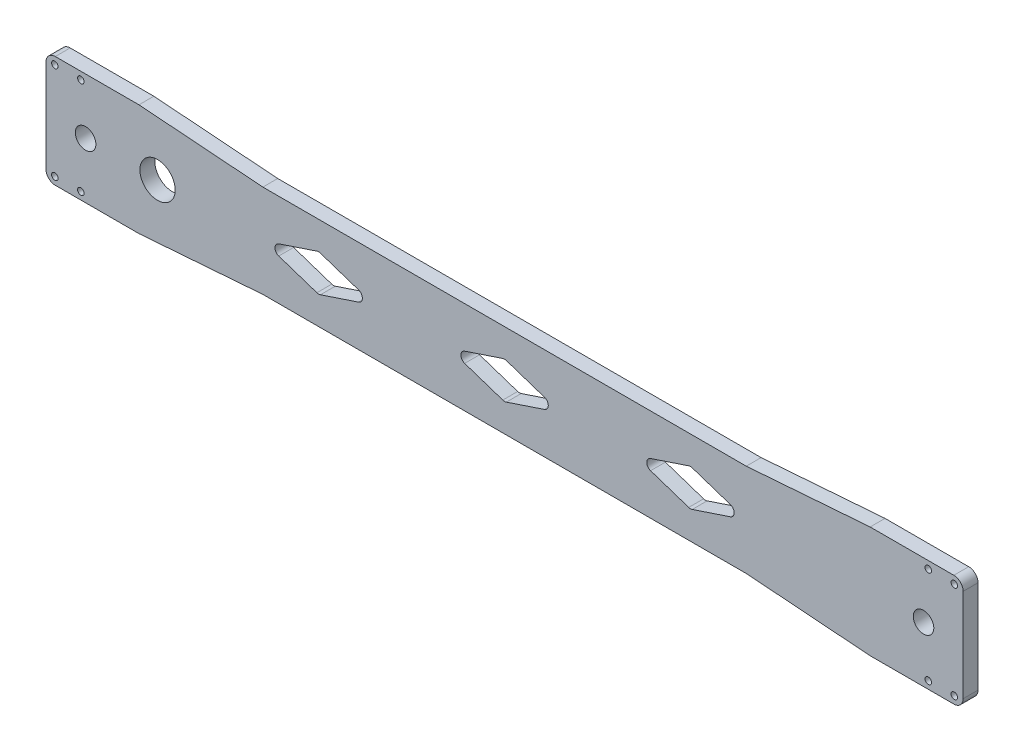
from build123d import *

# Parameters (mm, degrees)
EXTRUDE_1_DEPTH     = 8
FILLET_1_R          = 3
FILLET_2_R          = 5
SKETCH_2_R          = 1.75
SKETCH_2_R_2        = 5.525
CUT_EXTRUDE_1_DEPTH = 10
SKETCH_3_R          = 9.5
CUT_EXTRUDE_2_DEPTH = 497.999889336


with BuildPart() as part:
    # 草图1 → 凸台-拉伸1 (new body)
    with BuildSketch(Plane.XY):
        Polygon((0, 0), (50, 0), (116.65, -5), (376.65, -5), (443.3, 0), (493.3, 0), (493.3, -60), (443.3, -60), (376.65, -55), (116.65, -55), (50, -60), (0, -60), align=None)
        Polygon((116.65, -30), (146.65, -20), (176.65, -30), (146.65, -40), align=None, mode=Mode.SUBTRACT)
        Polygon((216.65, -30), (246.65, -20), (276.65, -30), (246.65, -40), align=None, mode=Mode.SUBTRACT)
        Polygon((316.65, -30), (346.65, -20), (376.65, -30), (346.65, -40), align=None, mode=Mode.SUBTRACT)
    extrude(amount=EXTRUDE_1_DEPTH)

    # 圆角1
    fillet_1_edges = [part.edges().sort_by_distance(p)[0] for p in [
        (216.65, -30, 4),
        (246.65, -40, 4),
        (276.65, -30, 4),
        (246.65, -20, 4),
        (116.65, -30, 4),
        (146.65, -40, 4),
        (176.65, -30, 4),
        (146.65, -20, 4),
        (316.65, -30, 4),
        (346.65, -40, 4),
        (376.65, -30, 4),
        (346.65, -20, 4),
    ]]
    fillet(fillet_1_edges, radius=FILLET_1_R)

    # 圆角2
    fillet_2_edges = [part.edges().sort_by_distance(p)[0] for p in [
        (0, 0, 4),
        (493.3, 0, 4),
        (493.3, -60, 4),
        (0, -60, 4),
    ]]
    fillet(fillet_2_edges, radius=FILLET_2_R)

    # 草图2 → 切除-拉伸1 (cut)
    with BuildSketch(Plane.XY.offset(8)):
        with Locations((4.75, -4)):
            Circle(SKETCH_2_R)
        with Locations((18.75, -4)):
            Circle(SKETCH_2_R)
        with Locations((18.75, -56)):
            Circle(SKETCH_2_R)
        with Locations((4.75, -56)):
            Circle(SKETCH_2_R)
        with Locations((21.3, -30)):
            Circle(SKETCH_2_R_2)
        with Locations((488.55, -4)):
            Circle(SKETCH_2_R)
        with Locations((474.55, -4)):
            Circle(SKETCH_2_R)
        with Locations((474.55, -56)):
            Circle(SKETCH_2_R)
        with Locations((488.55, -56)):
            Circle(SKETCH_2_R)
        with Locations((472, -30)):
            Circle(SKETCH_2_R_2)
    extrude(amount=-CUT_EXTRUDE_1_DEPTH, mode=Mode.SUBTRACT)

    # 草图3 → 切除-拉伸2 (cut, through all)
    with BuildSketch(Plane.XY.offset(8)):
        with Locations((60, -30)):
            Circle(SKETCH_3_R)
    extrude(amount=-CUT_EXTRUDE_2_DEPTH, mode=Mode.SUBTRACT)


solid = part.part
